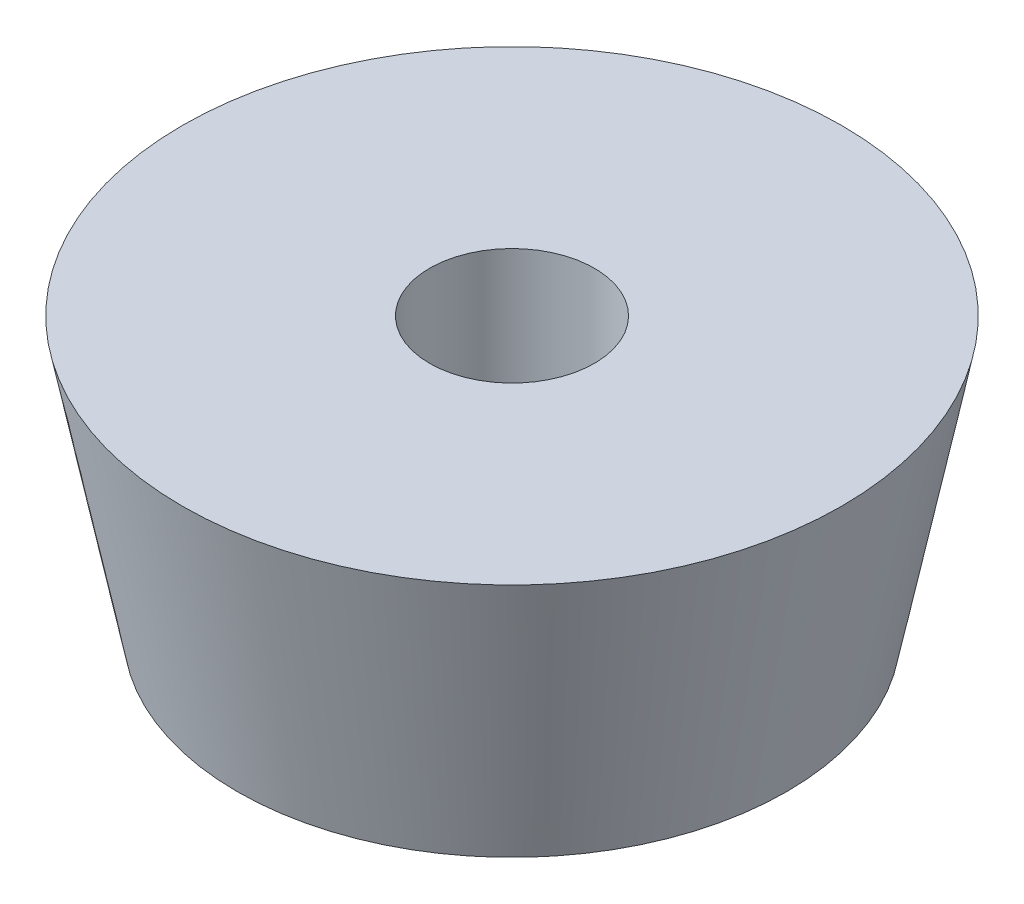
from build123d import *


with BuildPart() as part:
    # Sketch1 → Revolve1 (revolve)
    with BuildSketch(Plane.XY, mode=Mode.PRIVATE) as revolve1_sk:
        Polygon((1.5, 0), (5, 0), (6.000006128, 5), (1.5, 5), align=None)
    revolve(revolve1_sk.sketch.rotate(Axis((0, 7.929576713, 0), (0, -1, 0)), 90), axis=Axis((0, 7.929576713, 0), (0, -1, 0)))


solid = part.part
